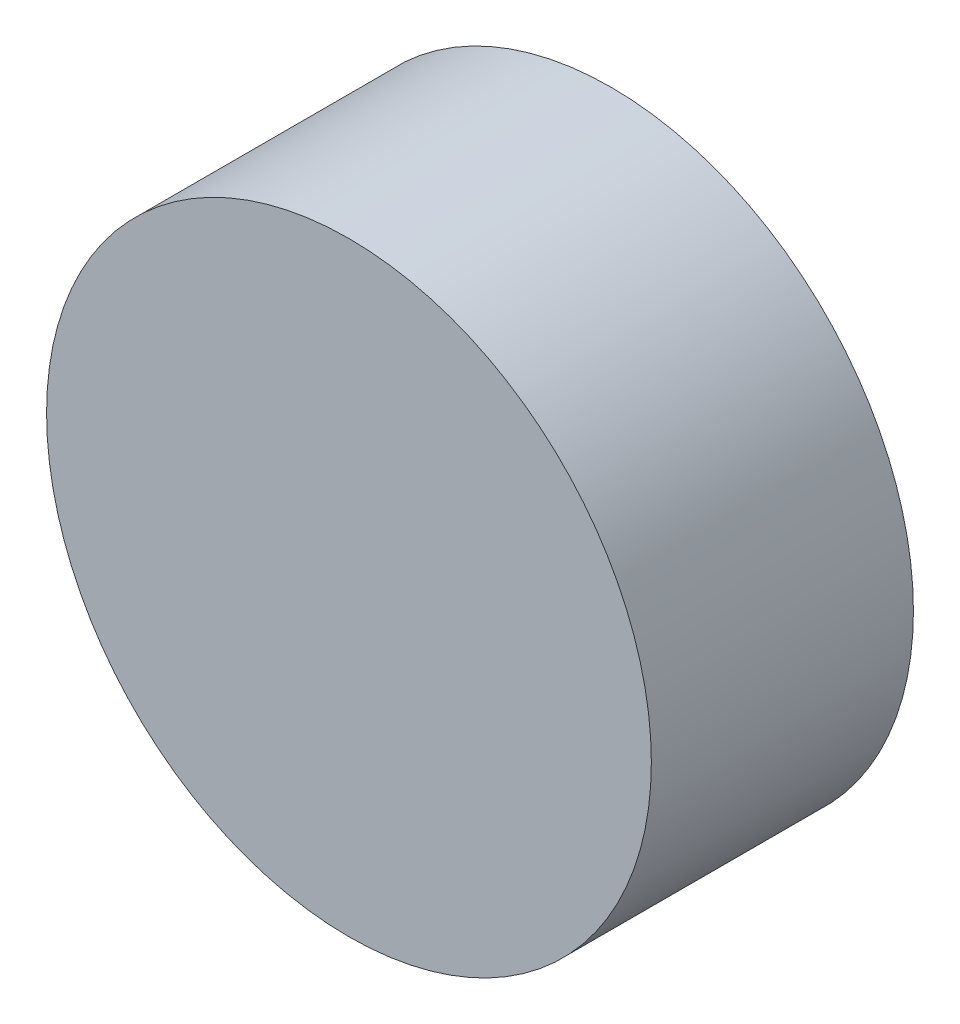
from build123d import *

# Parameters (mm, degrees)
SKETCH1_R           = 30
BOSS_EXTRUDE1_DEPTH = 26
CUT_EXTRUDE1_START  = -26
SKETCH2_R           = 3
CUT_EXTRUDE1_DEPTH  = 10


with BuildPart() as part:
    # Sketch1 → Boss-Extrude1 (new body)
    with BuildSketch(Plane.XY):
        with Locations(Location((0, 0, 0), (0, 0, 180))):
            Circle(SKETCH1_R)
    extrude(amount=BOSS_EXTRUDE1_DEPTH)

    # Sketch2 → Cut-Extrude1 (cut)
    with BuildSketch(Plane.XY.offset(26).offset(CUT_EXTRUDE1_START)):
        Circle(SKETCH2_R)
    extrude(amount=CUT_EXTRUDE1_DEPTH, mode=Mode.SUBTRACT)


solid = part.part
